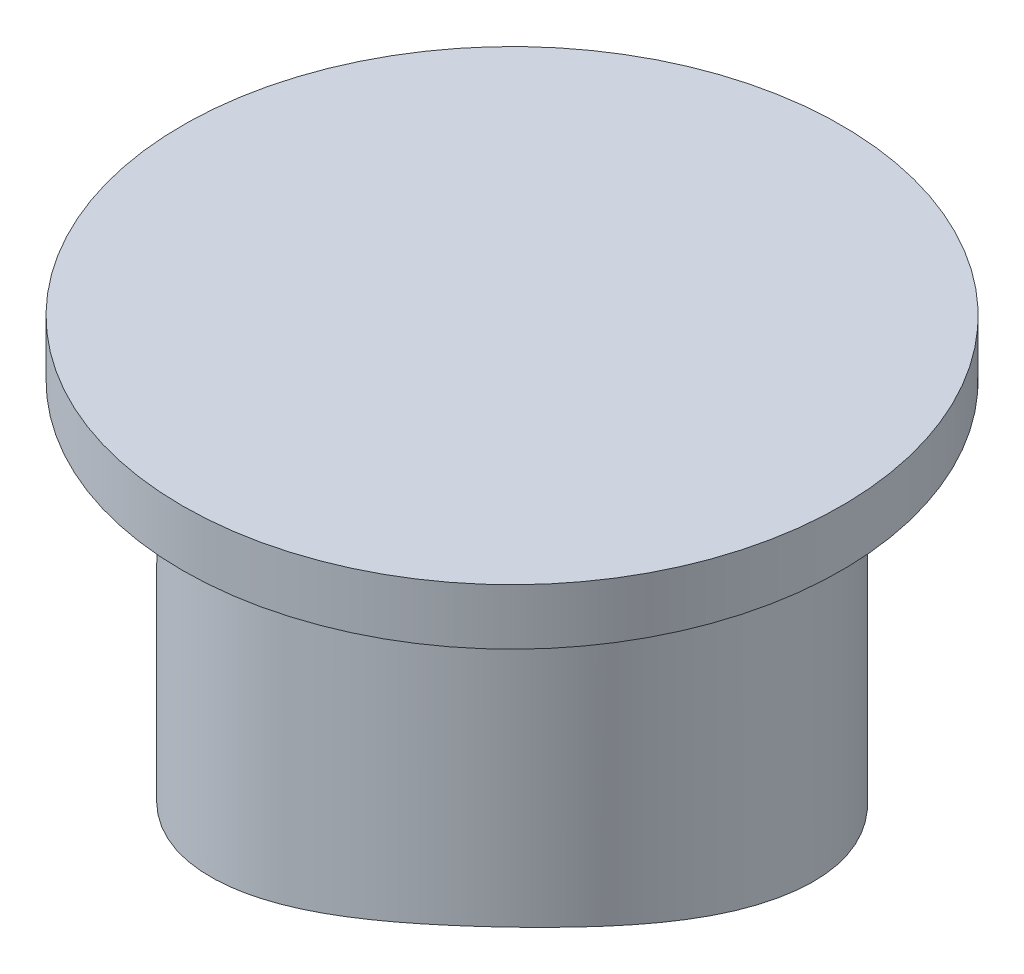
from build123d import *

# Parameters (mm, degrees)
SKETCH2_R           = 29.5
BOSS_EXTRUDE1_DEPTH = 5
SKETCH3_R           = 22.5
BOSS_EXTRUDE2_DEPTH = 100
CUT_EXTRUDE1_DEPTH  = 181


with BuildPart() as part:
    # Sketch2 → Boss-Extrude1 (new body)
    with BuildSketch(Plane(origin=(0, 0, 0), x_dir=(1, 0, 0), z_dir=(0, 1, 0))):
        with Locations(Location((0, 0, 0), (0, 0, 270))):
            Circle(SKETCH2_R)
    extrude(amount=BOSS_EXTRUDE1_DEPTH)

    # Sketch3 → Boss-Extrude2 (add)
    with BuildSketch(Plane.XZ):
        with Locations(Location((0, 0, 0), (0, 0, 270))):
            Circle(SKETCH3_R)
    extrude(amount=BOSS_EXTRUDE2_DEPTH)

    # Sketch4 → Cut-Extrude1 (cut)
    with BuildSketch(Plane(origin=(-63.996216882, 0, 59.671888061), x_dir=(0.6819644349807488, 0, 0.7313853357987076), z_dir=(-0.7313853357987076, 0, 0.6819644349807488))):
        with BuildLine():
            Line((-29.125423753, -34.169486826), (-29.125423753, -106.993301149))
            Line((-29.125423753, -106.993301149), (28.333748465, -106.993301149))
            Line((28.333748465, -106.993301149), (28.333748465, -22.496404242))
            add(Edge.make_bspline(
                [(-29.125423753, -34.169486826), (-19.027495219, -34.227173533), (-4.480834303, -34.028222863), (14.926714819, -29.772095296), (24.25688535, -26.283529721), (28.333748465, -22.496404242)],
                knots=[0, 0, 0, 0, 0.508723689, 0.724602868, 1, 1, 1, 1], degree=3))
        make_face()
    extrude(amount=-CUT_EXTRUDE1_DEPTH, mode=Mode.SUBTRACT)


solid = part.part
